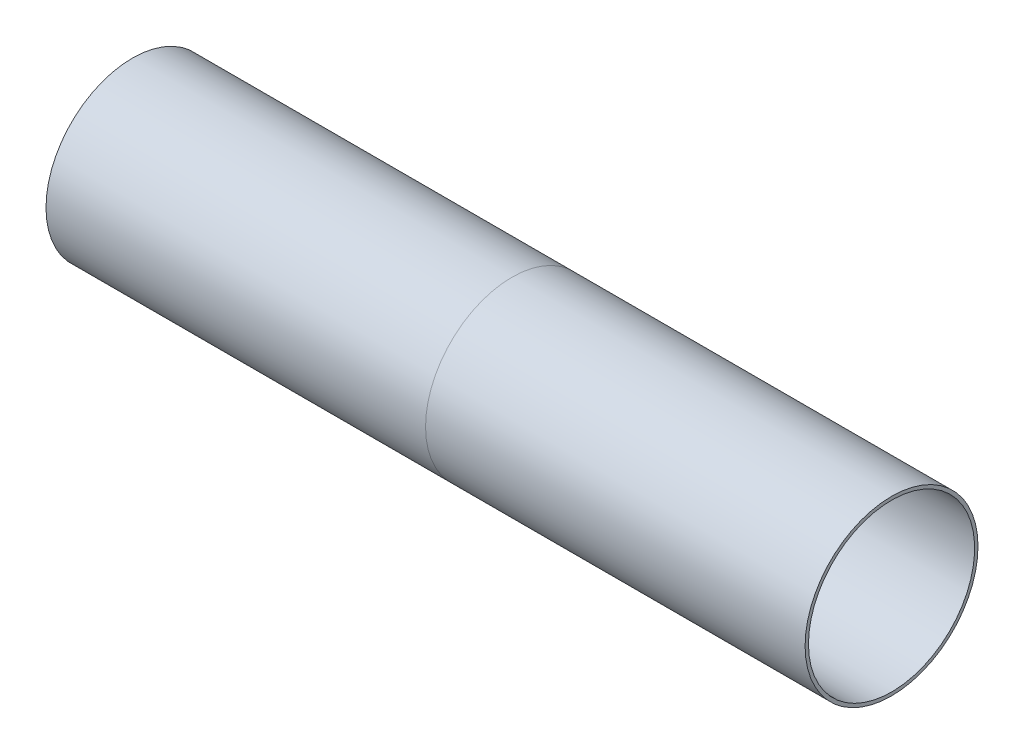
from build123d import *


with BuildPart() as part:
    # Sketch2 → Revolve1 (revolve)
    with BuildSketch(Plane(origin=(0, 0, 0), x_dir=(1, 0, 0), z_dir=(0, 1, 0))):
        Polygon((180, 39.4), (180, 41), (0, 41), (0, 39.4), (11.430052303, 38.4), (12.430052303, 39.4), align=None)
    revolve(axis=Axis((0, 0, 0), (1, 0, 0)))


with BuildPart() as body_2:
    # Sketch2<3> → Revolve2 (revolve)
    with BuildSketch(Plane(origin=(0, 0, 0), x_dir=(1, 0, 0), z_dir=(0, 1, 0))):
        Polygon((0, 39.4), (0, 41), (-180, 41), (-180, 39.4), (-168.569947697, 38.4), (-167.569947697, 39.4), (-12.430052303, 39.4), (-11.430052303, 38.4), align=None)
    revolve(axis=Axis((0, 0, 0), (1, 0, 0)))


with BuildPart() as body_3:
    # Sketch3 → Revolve3 (revolve)
    with BuildSketch(Plane(origin=(0, 0, 0), x_dir=(1, 0, 0), z_dir=(0, 1, 0))):
        Polygon((-11.430052303, 38.4), (0, 39.4), (11.430052303, 38.4), (11.430052303, 37.2), (-11.430052303, 37.2), align=None)
    revolve(axis=Axis((0, 0, 0), (1, 0, 0)))


solid = Compound([part.part, body_2.part, body_3.part])
